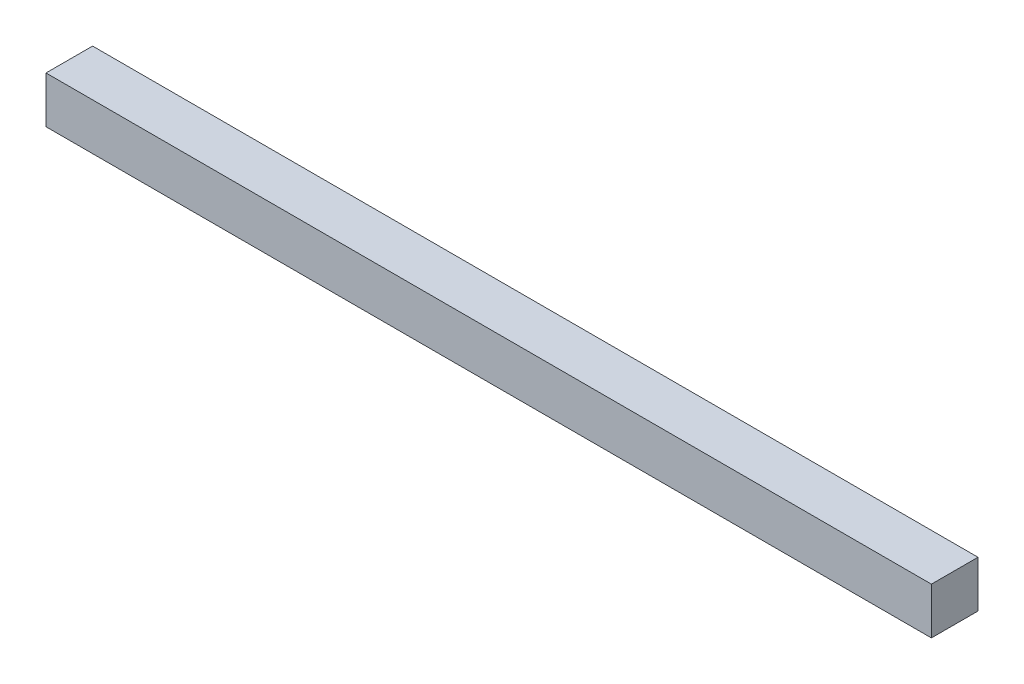
from build123d import *

# Parameters (mm, degrees)
SKETCH1_W           = 241.3
SKETCH1_H           = 12.7
BOSS_EXTRUDE1_DEPTH = 12.7


with BuildPart() as part:
    # Sketch1 → Boss-Extrude1 (new body)
    with BuildSketch(Plane(origin=(0, 0, 0), x_dir=(1, 0, 0), z_dir=(0, 1, 0))):
        with Locations((66.709413196, 22.59401611)):
            Rectangle(SKETCH1_W, SKETCH1_H)
    extrude(amount=BOSS_EXTRUDE1_DEPTH)


solid = part.part
